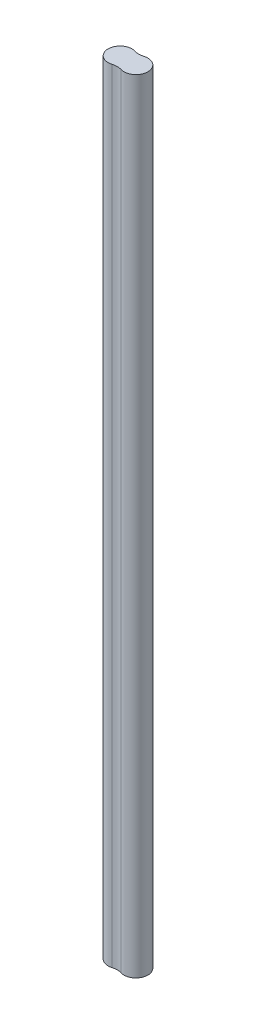
from build123d import *

# Parameters (mm, degrees)
BOSS_EXTRUDE1_DEPTH = 100
FILLET1_R           = 2


with BuildPart() as part:
    # Sketch1 → Boss-Extrude1 (new body)
    with BuildSketch(Plane(origin=(0, 0, 0), x_dir=(1, 0, 0), z_dir=(0, 1, 0))):
        with BuildLine():
            ThreePointArc((1.016, 1.135922533), (-1.524, 0), (1.016, -1.135922533))
            ThreePointArc((1.016, -1.135922533), (3.556, 0), (1.016, 1.135922533))
        make_face()
    extrude(amount=BOSS_EXTRUDE1_DEPTH)

    # Fillet1
    fillet1_edges = [part.edges().sort_by_distance(p)[0] for p in [
        (1.016, 50, 1.135922533),
        (1.016, 50, -1.135922533),
    ]]
    fillet(fillet1_edges, radius=FILLET1_R)


solid = part.part
